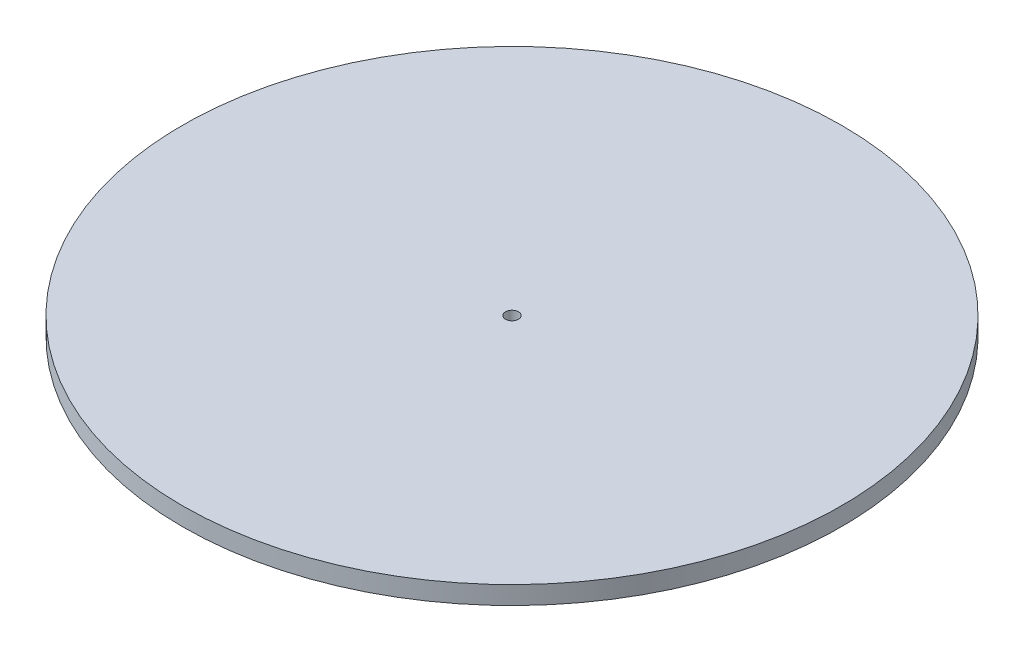
from build123d import *

# Parameters (mm, degrees)
SKETCH_1_R          = 127
EXTRUDE_1_DEPTH     = 7
CUT_EXTRUDE_1_REACH = 181.741
SKETCH_2_R          = 2.5


with BuildPart() as part:
    # 草图1 → 凸台-拉伸1 (new body)
    with BuildSketch(Plane(origin=(0, 0, 0), x_dir=(1, 0, 0), z_dir=(0, 1, 0))):
        with Locations(Location((0, 0, 0), (0, 0, 270))):
            Circle(SKETCH_1_R)
    extrude(amount=EXTRUDE_1_DEPTH)

    # 草图2 → 切除-拉伸1 (cut, up to next)
    with BuildSketch(Plane(origin=(0, 7, 0), x_dir=(1, 0, 0), z_dir=(0, 1, 0)), mode=Mode.PRIVATE) as cut_extrude_1_sk1:
        with Locations(Location((0, 0, 0), (0, 0, 270))):
            Circle(SKETCH_2_R)
    cut_extrude_1_tool1 = extrude(cut_extrude_1_sk1.sketch, amount=-CUT_EXTRUDE_1_REACH, mode=Mode.PRIVATE) & part.part
    add(cut_extrude_1_tool1.solids().sort_by_distance((0, 7, 0))[0], mode=Mode.SUBTRACT)


solid = part.part
